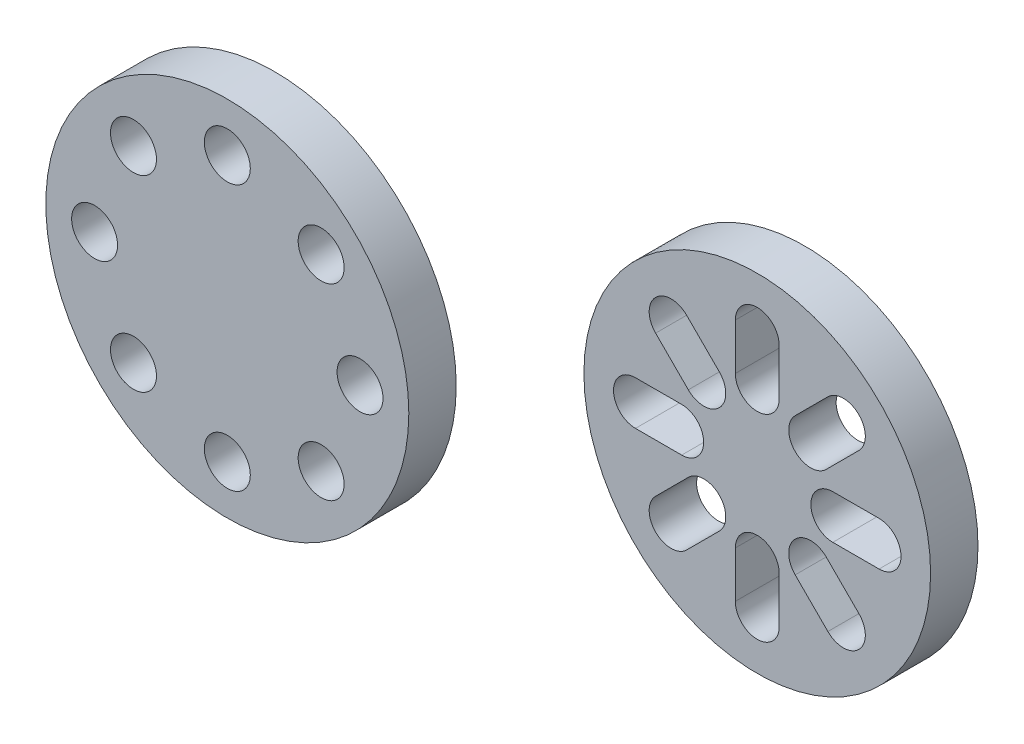
from build123d import *

# Parameters (mm, degrees)
SKETCH1_R             = 38.298642763
SKETCH1_R_2           = 4.849226706
BOSS_EXTRUDE1_DEPTH   = 10
SKETCH1_R_3           = 36.577057953
BOSS_EXTRUDE1_2_DEPTH = 10


with BuildPart() as part:
    # Sketch1 → Boss-Extrude1 (new body)
    with BuildSketch(Plane.XY):
        Circle(SKETCH1_R)
        with Locations((28.002059603, 0)):
            Circle(SKETCH1_R_2, mode=Mode.SUBTRACT)
        with Locations((19.800446232, -19.800446232)):
            Circle(SKETCH1_R_2, mode=Mode.SUBTRACT)
        with Locations((0, -28.002059603)):
            Circle(SKETCH1_R_2, mode=Mode.SUBTRACT)
        with Locations((-19.800446232, -19.800446232)):
            Circle(SKETCH1_R_2, mode=Mode.SUBTRACT)
        with Locations((-28.002059603, 0)):
            Circle(SKETCH1_R_2, mode=Mode.SUBTRACT)
        with Locations((-19.800446232, 19.800446232)):
            Circle(SKETCH1_R_2, mode=Mode.SUBTRACT)
        with Locations((0, 28.002059603)):
            Circle(SKETCH1_R_2, mode=Mode.SUBTRACT)
        with Locations((19.800446232, 19.800446232)):
            Circle(SKETCH1_R_2, mode=Mode.SUBTRACT)
    extrude(amount=BOSS_EXTRUDE1_DEPTH)


with BuildPart() as body_2:
    # Sketch1 → Boss-Extrude1 2 (new body)
    with BuildSketch(Plane.XY):
        with Locations((111.816443481, 25.796417922)):
            Circle(SKETCH1_R_3)
        with BuildLine():
            Line((127.757552755, 30.425601298), (137.516963938, 30.425601298))
            ThreePointArc((137.516963938, 30.425601298), (142.146147315, 25.796417922), (137.516963938, 21.167234545))
            Line((137.516963938, 21.167234545), (127.757552755, 21.167234545))
            ThreePointArc((127.757552755, 21.167234545), (123.128369378, 25.796417922), (127.757552755, 30.425601298))
        make_face(mode=Mode.SUBTRACT)
        with BuildLine():
            Line((126.361836905, 17.797678412), (133.262782733, 10.896732583))
            ThreePointArc((133.262782733, 10.896732583), (133.262782733, 4.35007867), (126.71612882, 4.35007867))
            Line((126.71612882, 4.35007867), (119.815182991, 11.251024498))
            ThreePointArc((119.815182991, 11.251024498), (119.815182991, 17.797678412), (126.361836905, 17.797678412))
        make_face(mode=Mode.SUBTRACT)
        with BuildLine():
            Line((116.445626858, 9.855308648), (116.445626858, 0.095897464))
            ThreePointArc((116.445626858, 0.095897464), (111.816443481, -4.533285912), (107.187260105, 0.095897464))
            Line((107.187260105, 0.095897464), (107.187260105, 9.855308648))
            ThreePointArc((107.187260105, 9.855308648), (111.816443481, 14.484492025), (116.445626858, 9.855308648))
        make_face(mode=Mode.SUBTRACT)
        with BuildLine():
            Line((103.817703971, 11.251024498), (96.916758143, 4.35007867))
            ThreePointArc((96.916758143, 4.35007867), (90.370104229, 4.35007867), (90.370104229, 10.896732583))
            Line((90.370104229, 10.896732583), (97.271050058, 17.797678412))
            ThreePointArc((97.271050058, 17.797678412), (103.817703971, 17.797678412), (103.817703971, 11.251024498))
        make_face(mode=Mode.SUBTRACT)
        with BuildLine():
            Line((95.875334208, 21.167234545), (86.115923024, 21.167234545))
            ThreePointArc((86.115923024, 21.167234545), (81.486739648, 25.796417922), (86.115923024, 30.425601298))
            Line((86.115923024, 30.425601298), (95.875334208, 30.425601298))
            ThreePointArc((95.875334208, 30.425601298), (100.504517584, 25.796417922), (95.875334208, 21.167234545))
        make_face(mode=Mode.SUBTRACT)
        with BuildLine():
            Line((97.271050058, 33.795157432), (90.370104229, 40.69610326))
            ThreePointArc((90.370104229, 40.69610326), (90.370104229, 47.242757173), (96.916758143, 47.242757173))
            Line((96.916758143, 47.242757173), (103.817703971, 40.341811345))
            ThreePointArc((103.817703971, 40.341811345), (103.817703971, 33.795157432), (97.271050058, 33.795157432))
        make_face(mode=Mode.SUBTRACT)
        with BuildLine():
            Line((107.187260105, 41.737527195), (107.187260105, 51.496938379))
            ThreePointArc((107.187260105, 51.496938379), (111.816443481, 56.126121755), (116.445626858, 51.496938379))
            Line((116.445626858, 51.496938379), (116.445626858, 41.737527195))
            ThreePointArc((116.445626858, 41.737527195), (111.816443481, 37.108343818), (107.187260105, 41.737527195))
        make_face(mode=Mode.SUBTRACT)
        with BuildLine():
            Line((119.815182991, 40.341811345), (126.71612882, 47.242757173))
            ThreePointArc((126.71612882, 47.242757173), (133.262782733, 47.242757173), (133.262782733, 40.69610326))
            Line((133.262782733, 40.69610326), (126.361836905, 33.795157432))
            ThreePointArc((126.361836905, 33.795157432), (119.815182991, 33.795157432), (119.815182991, 40.341811345))
        make_face(mode=Mode.SUBTRACT)
    extrude(amount=BOSS_EXTRUDE1_2_DEPTH)


solid = Compound([part.part, body_2.part])
